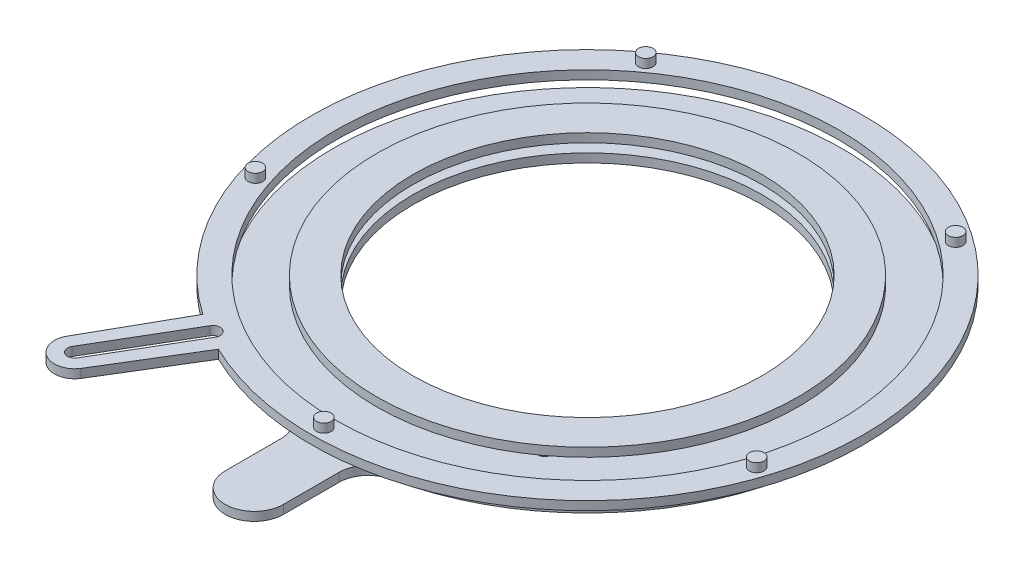
from build123d import *

# Parameters (mm, degrees)
SKETCH_1_R               = 72.5
SKETCH_1_R_2             = 60
EXTRUDE_1_DEPTH          = 3
SKETCH_2_R               = 2.5
EXTRUDE_2_DEPTH          = 3
PATTERN_CIRCULAR_1_COUNT = 5
EXTRUDE_START            = 3
SKETCH_3_R               = 60
EXTRUDE_3_DEPTH          = 3
SKETCH_4_R               = 86.5
EXTRUDE_4_DEPTH          = 3
SKETCH_7_R               = 2.5
EXTRUDE_7_DEPTH          = 3
PATTERN_CIRCULAR_5_COUNT = 5
CUT_EXTRUDE_1_DEPTH      = 3


with BuildPart() as part:
    # 草图1 → 凸台-拉伸1 (new body)
    with BuildSketch(Plane(origin=(0, 0, 0), x_dir=(1, 0, 0), z_dir=(0, 1, 0))):
        with Locations(Location((0, 0, 0), (0, 0, 270))):
            Circle(SKETCH_1_R)
        with Locations(Location((0, 0, 0), (0, 0, 270))):
            Circle(SKETCH_1_R_2, mode=Mode.SUBTRACT)
    extrude(amount=EXTRUDE_1_DEPTH)

    # 草图2 → 凸台-拉伸2 (add)
    with BuildSketch(Plane(origin=(0, 0, 0), x_dir=(1, 0, 0), z_dir=(0, 1, 0))):
        with Locations(Location((0, 66.25, 0), (0, 0, 270))):
            Circle(SKETCH_2_R)
    extrude_2 = extrude(amount=-EXTRUDE_2_DEPTH)

    # 阵列(圆周)1: 凸台-拉伸2 ×5 about axis
    pattern_circular_1_axis = Axis((0, 0, 0), (0, 1, 0))
    for i in range(1, PATTERN_CIRCULAR_1_COUNT):
        add(extrude_2.rotate(pattern_circular_1_axis, i * 360 / PATTERN_CIRCULAR_1_COUNT))

    # 草图3 → 凸台-拉伸3 (add)
    with BuildSketch(Plane.XZ.offset(3).offset(EXTRUDE_START)):
        with BuildLine():
            Line((10, 114.58706304), (10, 95.42667342))
            ThreePointArc((10, 95.42667342), (12.237499742, 89.1224217), (17.948717949, 85.6393223))
            ThreePointArc((17.948717949, 85.6393223), (0, -87.5), (-17.948717949, 85.6393223))
            ThreePointArc((-17.948717949, 85.6393223), (-12.237499742, 89.1224217), (-10, 95.42667342))
            Line((-10, 95.42667342), (-10, 114.58706304))
            ThreePointArc((-10, 114.58706304), (0, 124.58706304), (10, 114.58706304))
        make_face()
        with Locations(Location((0, 0, 0), (0, 0, 90))):
            Circle(SKETCH_3_R, mode=Mode.SUBTRACT)
    extrude(amount=-EXTRUDE_3_DEPTH)


with BuildPart() as body_2:
    # 草图4 → 凸台-拉伸4 (new body)
    with BuildSketch(Plane(origin=(0, 0, 0), x_dir=(1, 0, 0), z_dir=(0, 1, 0))):
        with BuildLine():
            Line((-71.235028952, -107.523774466), (-54.480369424, -77.826019733))
            ThreePointArc((-54.480369424, -77.826019733), (48.092738476, 81.927336743), (-41.398046023, -85.505565816))
            Line((-41.398046023, -85.505565816), (-59.338433855, -114.90031295))
            ThreePointArc((-59.338433855, -114.90031295), (-68.912249243, -117.059138228), (-71.235028952, -107.523774466))
        make_face()
        with Locations(Location((0, 0, 0), (0, 0, 270))):
            Circle(SKETCH_4_R, mode=Mode.SUBTRACT)
    extrude(amount=EXTRUDE_4_DEPTH)

    # 草图7 → 凸台-拉伸7 (add)
    with BuildSketch(Plane(origin=(0, 3, 0), x_dir=(1, 0, 0), z_dir=(0, 1, 0))):
        with Locations(Location((0, -90.642629317, 0), (0, 0, 270))):
            Circle(SKETCH_7_R)
    extrude_7 = extrude(amount=EXTRUDE_7_DEPTH)

    # 阵列(圆周)5: 凸台-拉伸7 ×5 about axis
    pattern_circular_5_axis = Axis((0, 0, 0), (0, 1, 0))
    for i in range(1, PATTERN_CIRCULAR_5_COUNT):
        add(extrude_7.rotate(pattern_circular_5_axis, i * 360 / PATTERN_CIRCULAR_5_COUNT))

    # 草图9 → 切除-拉伸1 (cut)
    with BuildSketch(Plane(origin=(0, 0, 0), x_dir=(1, 0, 0), z_dir=(0, 1, 0))):
        with BuildLine():
            Line((-67.379419488, -109.844366475), (-49.822016323, -79.934834869))
            ThreePointArc((-49.822016323, -79.934834869), (-46.400435396, -79.044450705), (-45.510051231, -82.466031631))
            Line((-45.510051231, -82.466031631), (-63.067454396, -112.375563237))
            ThreePointArc((-63.067454396, -112.375563237), (-66.489035323, -113.265947402), (-67.379419488, -109.844366475))
        make_face()
    extrude(amount=CUT_EXTRUDE_1_DEPTH, mode=Mode.SUBTRACT)


solid = Compound([part.part, body_2.part])
